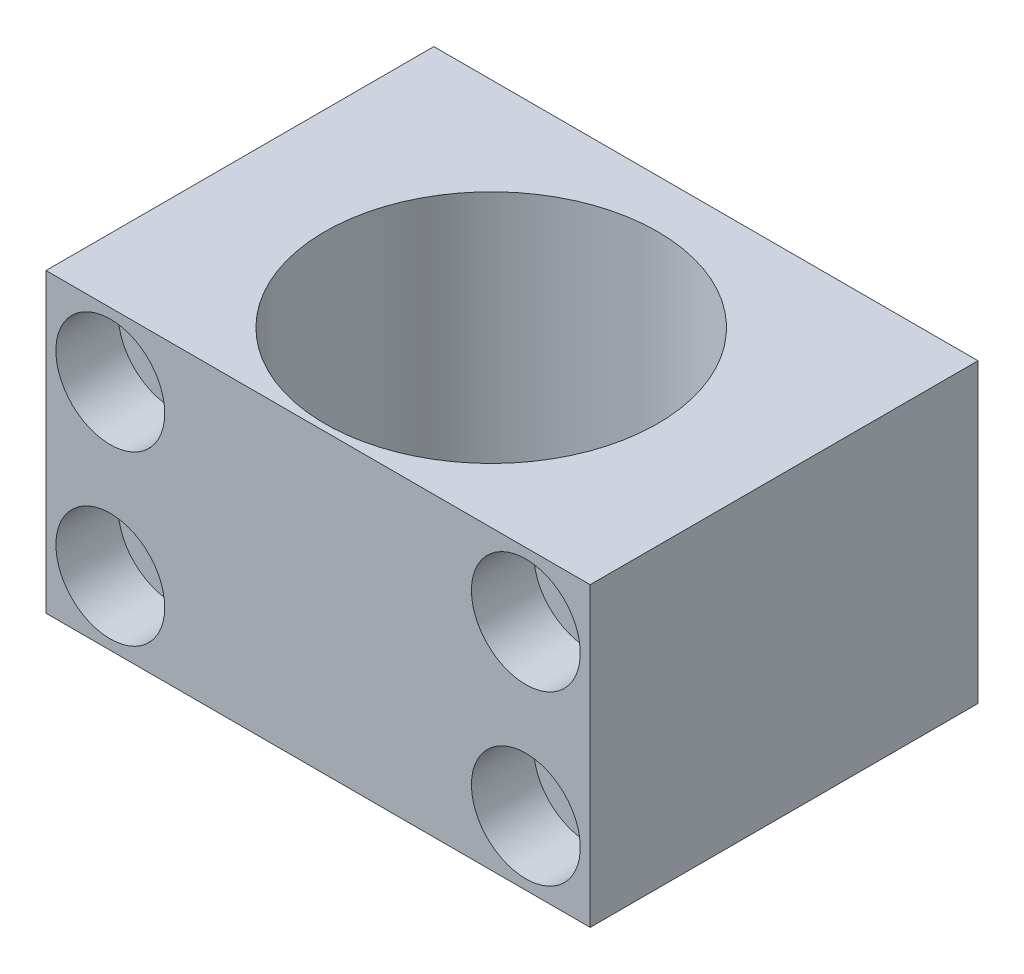
from build123d import *

# Parameters (mm, degrees)
SKETCH1_W           = 55
SKETCH1_H           = 39.2
BOSS_EXTRUDE1_DEPTH = 30
SKETCH2_R           = 16.818308595
CUT_EXTRUDE1_DEPTH  = 46.170897711
SKETCH3_R           = 5.5
CUT_EXTRUDE2_DEPTH  = 6.3
SKETCH5_R           = 3.25
CUT_EXTRUDE3_DEPTH  = 57.505663433


with BuildPart() as part:
    # Sketch1 → Boss-Extrude1 (new body)
    with BuildSketch(Plane(origin=(0, 0, 0), x_dir=(1, 0, 0), z_dir=(0, 1, 0))):
        Rectangle(SKETCH1_W, SKETCH1_H)
    extrude(amount=BOSS_EXTRUDE1_DEPTH)

    # Sketch2 → Cut-Extrude1 (cut, through all)
    with BuildSketch(Plane.XZ):
        with Locations(Location((0, 2.1, 0), (0, 0, 270))):
            Circle(SKETCH2_R)
    extrude(amount=-CUT_EXTRUDE1_DEPTH, mode=Mode.SUBTRACT)

    # Sketch3 → Cut-Extrude2 (cut)
    with BuildSketch(Plane.XY.offset(19.6)):
        with Locations((-21, 23.5)):
            Circle(SKETCH3_R)
        with Locations((-21, 6.5)):
            Circle(SKETCH3_R)
        with Locations(Location((21, 6.5, 0), (0, 0, 180))):
            Circle(SKETCH3_R)
        with Locations(Location((21, 23.5, 0), (0, 0, 180))):
            Circle(SKETCH3_R)
    extrude(amount=-CUT_EXTRUDE2_DEPTH, mode=Mode.SUBTRACT)

    # Sketch5 → Cut-Extrude3 (cut, through all)
    with BuildSketch(Plane.XY.offset(19.6)):
        with Locations((-21, 6.5)):
            Circle(SKETCH5_R)
        with Locations((-21, 23.5)):
            Circle(SKETCH5_R)
        with Locations(Location((21, 23.5, 0), (0, 0, 180))):
            Circle(SKETCH5_R)
        with Locations(Location((21, 6.5, 0), (0, 0, 180))):
            Circle(SKETCH5_R)
    extrude(amount=-CUT_EXTRUDE3_DEPTH, mode=Mode.SUBTRACT)


solid = part.part
